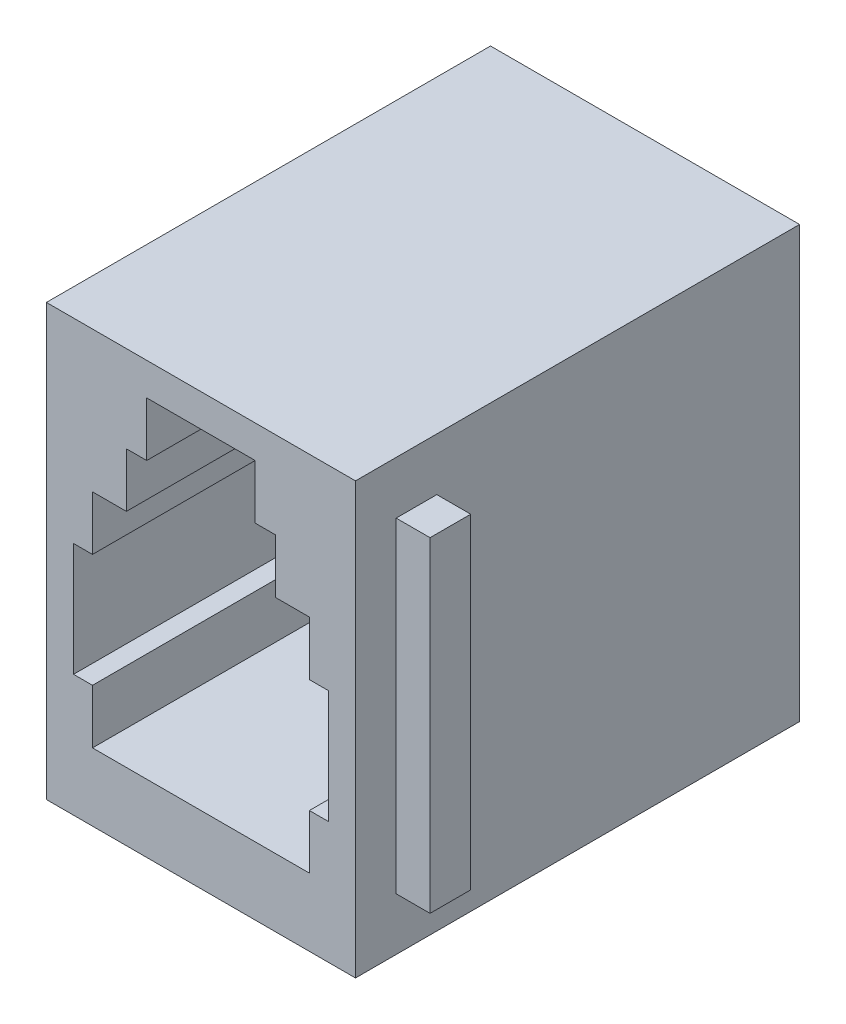
from build123d import *

# Parameters (mm, degrees)
SKETCH1_W           = 11.4
SKETCH1_H           = 15.88
BOSS_EXTRUDE1_DEPTH = 16.38
CUT_EXTRUDE1_DEPTH  = 15.38
SKETCH3_W           = 1.25
SKETCH3_H           = 1.5
BOSS_EXTRUDE2_DEPTH = 6


with BuildPart() as part:
    # Sketch1 → Boss-Extrude1 (new body)
    with BuildSketch(Plane.XY):
        Rectangle(SKETCH1_W, SKETCH1_H)
    extrude(amount=BOSS_EXTRUDE1_DEPTH)

    # Sketch2 → Cut-Extrude1 (cut)
    with BuildSketch(Plane.XY.offset(16.38)):
        Polygon((-2, 6.74), (2, 6.74), (2, 4.74), (2.75, 4.74), (2.75, 2.74), (4, 2.74), (4, 0.74), (4.7, 0.74), (4.7, -3.44), (4, -3.44), (4, -5.44), (-4, -5.44), (-4, -3.44), (-4.7, -3.44), (-4.7, 0.74), (-4, 0.74), (-4, 2.74), (-2.75, 2.74), (-2.75, 4.74), (-2, 4.74), align=None)
    extrude(amount=-CUT_EXTRUDE1_DEPTH, mode=Mode.SUBTRACT)

    # Sketch3 → Boss-Extrude2 (add, symmetric)
    with BuildSketch(Plane(origin=(0, 0, 0), x_dir=(1, 0, 0), z_dir=(0, 1, 0))):
        with Locations((6.325, -14.13)):
            Rectangle(SKETCH3_W, SKETCH3_H)
        with Locations((-6.325, -14.13)):
            Rectangle(SKETCH3_W, SKETCH3_H)
    extrude(amount=BOSS_EXTRUDE2_DEPTH, both=True)


solid = part.part
